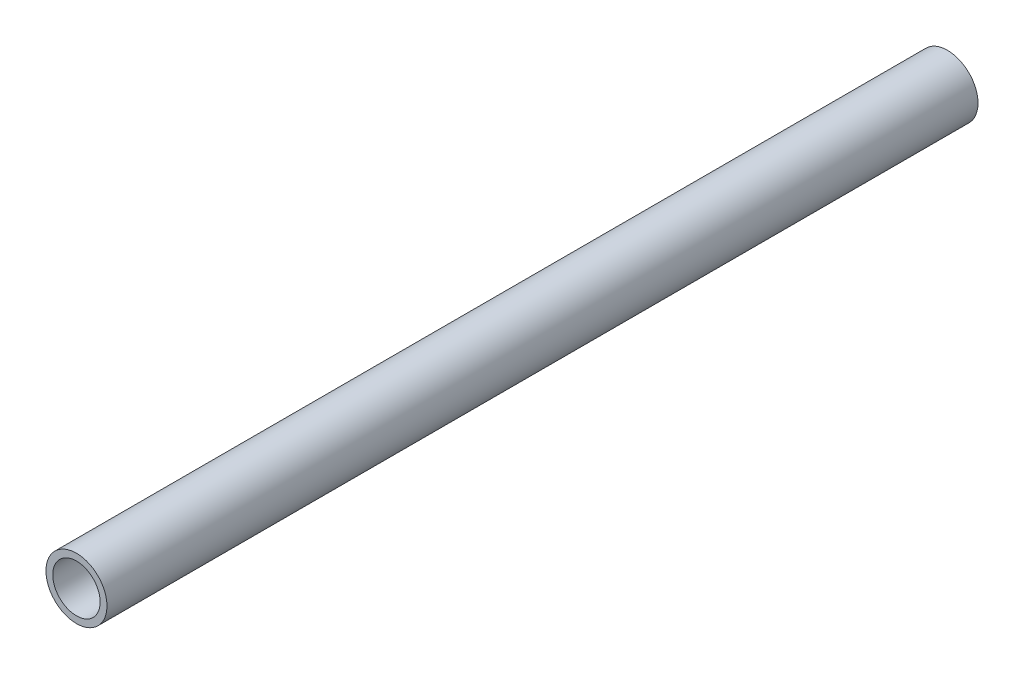
from build123d import *

# Parameters (mm, degrees)
SKETCH1_R           = 9
SKETCH1_R_2         = 7
BOSS_EXTRUDE1_DEPTH = 257


with BuildPart() as part:
    # Sketch1 → Boss-Extrude1 (new body)
    with BuildSketch(Plane.XY):
        Circle(SKETCH1_R)
        Circle(SKETCH1_R_2, mode=Mode.SUBTRACT)
    extrude(amount=BOSS_EXTRUDE1_DEPTH)


solid = part.part
